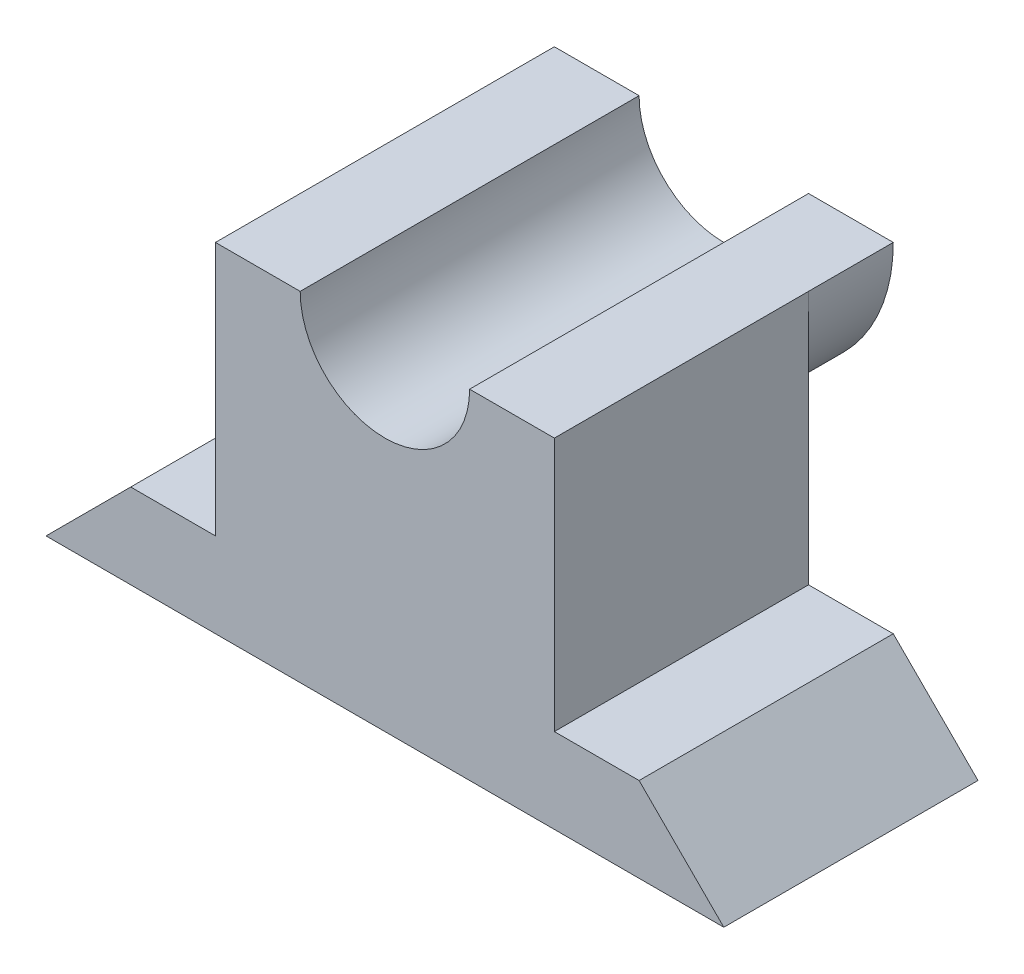
from build123d import *

# Parameters (mm, degrees)
EXTRUDE_1_DEPTH = 30
EXTRUDE_START   = 10
EXTRUDE_2_DEPTH = 10


with BuildPart() as part:
    # 草圖1 → 填料-伸長1 (new body)
    with BuildSketch(Plane.XY):
        with BuildLine():
            Line((0, -25.423322433), (0, -5.423322433))
            ThreePointArc((0, -5.423322433), (-14.142135624, 0.434541944), (-20, 14.576677567))
            Line((-20, 14.576677567), (-20, -15.423322433))
            Line((-20, -15.423322433), (-30, -15.423322433))
            Line((-30, -15.423322433), (-40, -25.423322433))
            Line((-40, -25.423322433), (0, -25.423322433))
        make_face()
        with BuildLine():
            ThreePointArc((20, 14.576677567), (14.142135624, 0.434541944), (0, -5.423322433))
            Line((0, -5.423322433), (0, -25.423322433))
            Line((0, -25.423322433), (40, -25.423322433))
            Line((40, -25.423322433), (30, -15.423322433))
            Line((30, -15.423322433), (20, -15.423322433))
            Line((20, -15.423322433), (20, 14.576677567))
        make_face()
        with BuildLine():
            ThreePointArc((10, 14.576677567), (7.071067812, 7.505609756), (0, 4.576677567))
            Line((0, 4.576677567), (0, -5.423322433))
            ThreePointArc((0, -5.423322433), (14.142135624, 0.434541944), (20, 14.576677567))
            Line((20, 14.576677567), (10, 14.576677567))
        make_face()
        with BuildLine():
            Line((0, -5.423322433), (0, 4.576677567))
            ThreePointArc((0, 4.576677567), (-7.071067812, 7.505609756), (-10, 14.576677567))
            Line((-10, 14.576677567), (-20, 14.576677567))
            ThreePointArc((-20, 14.576677567), (-14.142135624, 0.434541944), (0, -5.423322433))
        make_face()
        with BuildLine():
            ThreePointArc((10, 14.576677567), (7.071067812, 7.505609756), (0, 4.576677567))
            Line((0, 4.576677567), (0, -5.423322433))
            ThreePointArc((0, -5.423322433), (14.142135624, 0.434541944), (20, 14.576677567))
            Line((20, 14.576677567), (10, 14.576677567))
        make_face()
        with BuildLine():
            Line((0, -5.423322433), (0, 4.576677567))
            ThreePointArc((0, 4.576677567), (-7.071067812, 7.505609756), (-10, 14.576677567))
            Line((-10, 14.576677567), (-20, 14.576677567))
            ThreePointArc((-20, 14.576677567), (-14.142135624, 0.434541944), (0, -5.423322433))
        make_face()
    extrude(amount=EXTRUDE_1_DEPTH)

    # 草圖2 → 填料-伸長2 (add)
    with BuildSketch(Plane(origin=(0, 0, 0), x_dir=(-1, 0, 0), z_dir=(0, 0, -1)).offset(EXTRUDE_START)):
        with BuildLine():
            ThreePointArc((-20, 14.576677567), (0, -5.423322433), (20, 14.576677567))
            Line((20, 14.576677567), (10, 14.576677567))
            ThreePointArc((10, 14.576677567), (0, 4.576677567), (-10, 14.576677567))
            Line((-10, 14.576677567), (-20, 14.576677567))
        make_face()
    extrude(amount=-EXTRUDE_2_DEPTH)


solid = part.part
